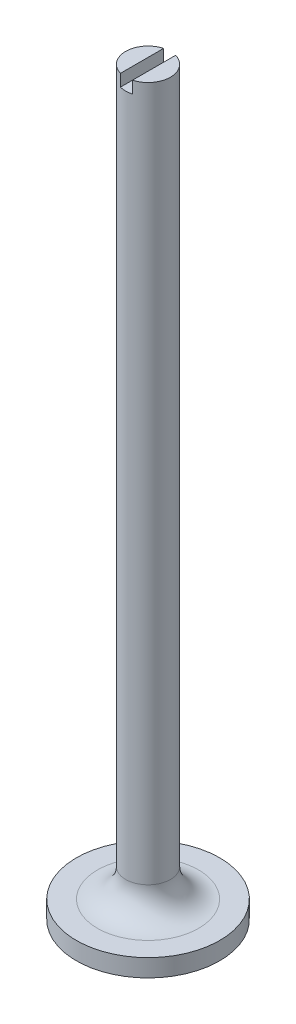
from build123d import *

# Parameters (mm, degrees)
FILLET1_R               = 4
CUT_EXTRUDE3_DEPTH      = 106.978541224
CUT_EXTRUDE3_DEPTH_BACK = 106.978541224
SKETCH4_W               = 1.7
SKETCH4_H               = 1.7


with BuildPart() as part:
    # Sketch1 → Revolve1 (revolve)
    with BuildSketch(Plane.XY, mode=Mode.PRIVATE) as revolve1_sk:
        Polygon((0, 0), (10.16, 0), (10.16, 2.5), (3.175, 2.5), (3.175, 105), (0, 105), align=None)
    revolve(revolve1_sk.sketch.rotate(Axis((0, -31.831703756, 0), (0, 1, 0)), 90), axis=Axis((0, -31.831703756, 0), (0, 1, 0)))

    # Fillet1
    fillet1_edges = [part.edges().sort_by_distance(p)[0] for p in [
        (0, 2.5, 3.175),
    ]]
    fillet(fillet1_edges, radius=FILLET1_R)

    # Sketch4 → Cut-Extrude3 (cut, two sides: drawn at the far end of the back side and taken through both)
    with BuildSketch(Plane.XY.offset(-CUT_EXTRUDE3_DEPTH_BACK)):
        with Locations((0, 104.15)):
            Rectangle(SKETCH4_W, SKETCH4_H)
    extrude(amount=CUT_EXTRUDE3_DEPTH + CUT_EXTRUDE3_DEPTH_BACK, mode=Mode.SUBTRACT)


solid = part.part
